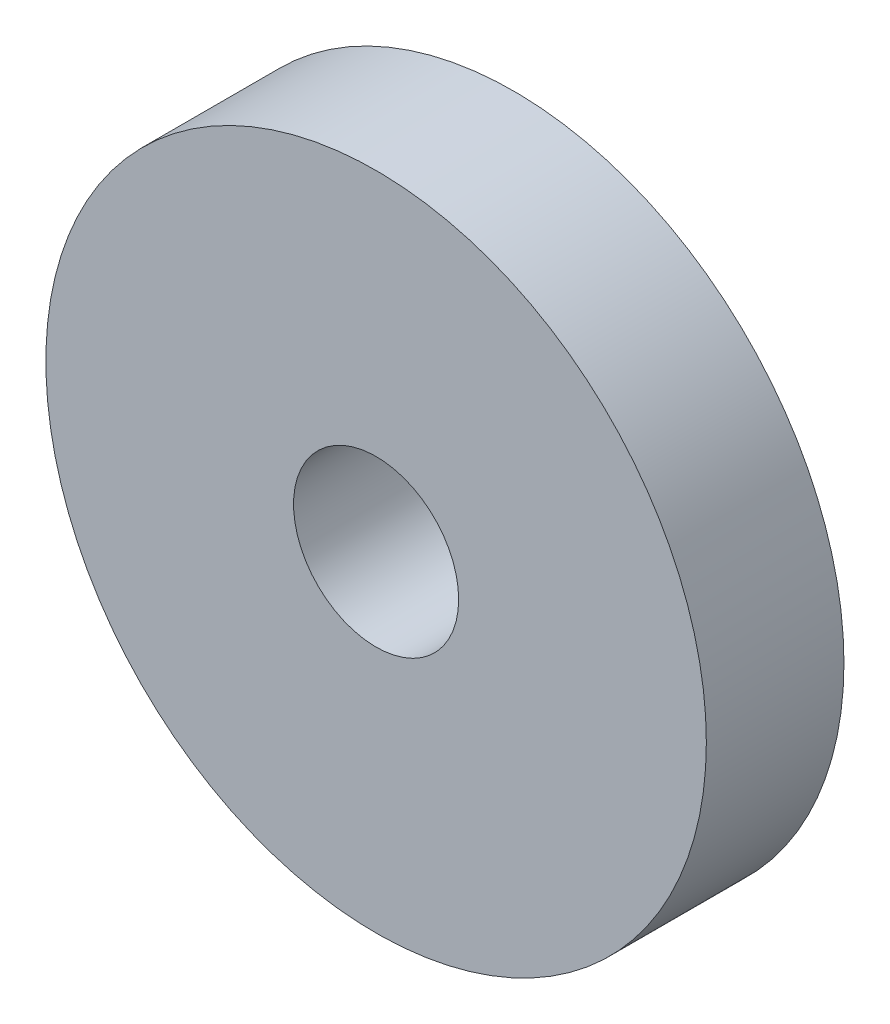
from build123d import *

# Parameters (mm, degrees)
SKETCH_1_R      = 12
SKETCH_1_R_2    = 3
EXTRUDE_1_DEPTH = 5


with BuildPart() as part:
    # 草图1 → 凸台-拉伸1 (new body)
    with BuildSketch(Plane.XY):
        Circle(SKETCH_1_R)
        Circle(SKETCH_1_R_2, mode=Mode.SUBTRACT)
    extrude(amount=EXTRUDE_1_DEPTH)


solid = part.part
